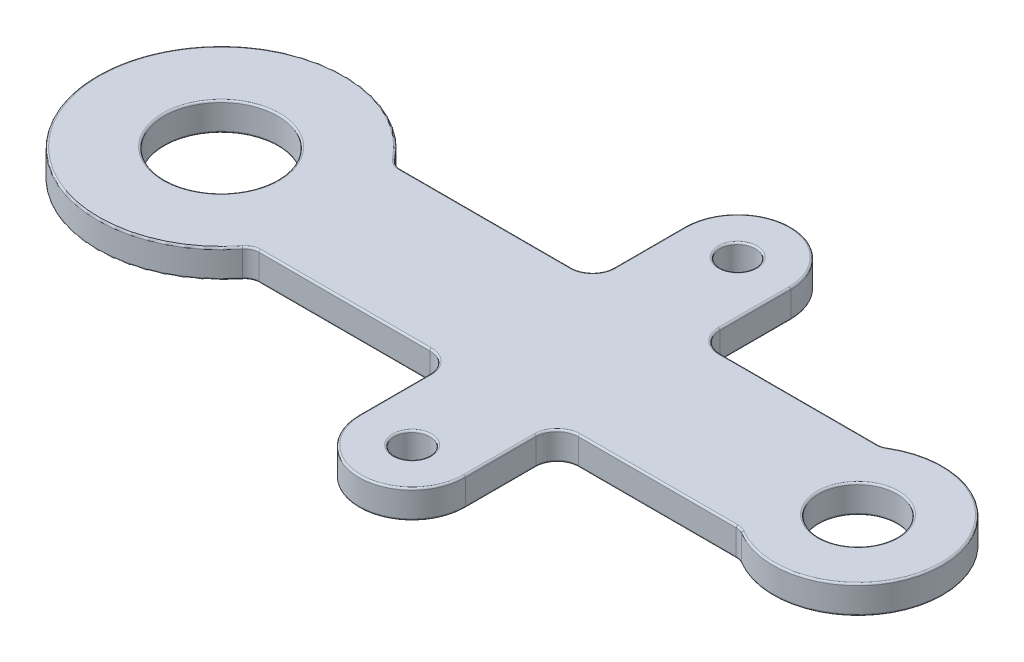
from build123d import *

# Parameters (mm, degrees)
SKETCH_1_R      = 16
SKETCH_1_R_2    = 5
SKETCH_1_R_3    = 11
EXTRUDE_2_DEPTH = 8
FILLET_1_R      = 6
FILLET_2_R      = 6
FILLET_3_R      = 6
FILLET_4_R      = 6
FILLET_5_R      = 4
FILLET_6_R      = 4
FILLET_7_R      = 4
FILLET_8_R      = 4
FILLET_9_R      = 0.5


with BuildPart() as part:
    # 草图1 → 凸台-拉伸2 (new body)
    with BuildSketch(Plane(origin=(0, 0, 0), x_dir=(1, 0, 0), z_dir=(0, 1, 0))):
        with BuildLine():
            Line((28.719409623, 20.004887175), (85, 20.004887175))
            Line((85, 20.004887175), (85, 46))
            ThreePointArc((85, 46), (100, 61), (115, 46))
            Line((115, 46), (115, 20.004887175))
            Line((115, 20.004887175), (166.74087148, 20.004887175))
            ThreePointArc((166.74087148, 20.004887175), (204, 0), (166.74087148, -20.004887175))
            Line((166.74087148, -20.004887175), (115, -20.004887175))
            Line((115, -20.004887175), (115, -46))
            ThreePointArc((115, -46), (100, -61), (85, -46))
            Line((85, -46), (85, -20.004887175))
            Line((85, -20.004887175), (28.719409623, -20.004887175))
            ThreePointArc((28.719409623, -20.004887175), (-35, 0), (28.719409623, 20.004887175))
        make_face()
        with Locations(Location((0, 0, 0), (0, 0, 270))):
            Circle(SKETCH_1_R, mode=Mode.SUBTRACT)
        with Locations(Location((100, 46, 0), (0, 0, 270))):
            Circle(SKETCH_1_R_2, mode=Mode.SUBTRACT)
        with Locations(Location((180, 0, 0), (0, 0, 270))):
            Circle(SKETCH_1_R_3, mode=Mode.SUBTRACT)
        with Locations(Location((100, -46, 0), (0, 0, 90))):
            Circle(SKETCH_1_R_2, mode=Mode.SUBTRACT)
    extrude(amount=EXTRUDE_2_DEPTH)

    # 圆角1
    fillet_1_edges = [part.edges().sort_by_distance(p)[0] for p in [
        (85, 4, -20.004887175),
    ]]
    fillet(fillet_1_edges, radius=FILLET_1_R)

    # 圆角2
    fillet_2_edges = [part.edges().sort_by_distance(p)[0] for p in [
        (115, 4, -20.004887175),
    ]]
    fillet(fillet_2_edges, radius=FILLET_2_R)

    # 圆角3
    fillet_3_edges = [part.edges().sort_by_distance(p)[0] for p in [
        (85, 4, 20.004887175),
    ]]
    fillet(fillet_3_edges, radius=FILLET_3_R)

    # 圆角4
    fillet_4_edges = [part.edges().sort_by_distance(p)[0] for p in [
        (115, 4, 20.004887175),
    ]]
    fillet(fillet_4_edges, radius=FILLET_4_R)

    # 圆角5
    fillet_5_edges = [part.edges().sort_by_distance(p)[0] for p in [
        (166.74087148, 4, 20.004887175),
    ]]
    fillet(fillet_5_edges, radius=FILLET_5_R)

    # 圆角6
    fillet_6_edges = [part.edges().sort_by_distance(p)[0] for p in [
        (28.719409623, 4, 20.004887175),
    ]]
    fillet(fillet_6_edges, radius=FILLET_6_R)

    # 圆角7
    fillet_7_edges = [part.edges().sort_by_distance(p)[0] for p in [
        (166.74087148, 4, -20.004887175),
    ]]
    fillet(fillet_7_edges, radius=FILLET_7_R)

    # 圆角8
    fillet_8_edges = [part.edges().sort_by_distance(p)[0] for p in [
        (28.719409623, 4, -20.004887175),
    ]]
    fillet(fillet_8_edges, radius=FILLET_8_R)

    # 圆角9
    fillet_9_edges = [part.edges().sort_by_distance(p)[0] for p in [
        (166.654322464, 8, 20.150209602),
        (54.868518078, 0, 20.004887175),
        (54.868518078, 8, 20.004887175),
        (28.983205897, 8, 20.409879606),
        (28.983205897, 0, 20.409879606),
        (85, 0, -36.002443588),
        (100, 0, -61),
        (143.292965386, 0, -20.004887175),
        (143.292965386, 8, -20.004887175),
        (166.654322464, 0, -20.150209602),
        (166.654322464, 8, -20.150209602),
        (100, 8, 61),
        (-35, 0, 0),
        (-35, 8, 0),
        (28.983205897, 0, -20.409879606),
        (28.983205897, 8, -20.409879606),
        (115, 0, 36.002443588),
        (100, 0, 61),
        (115, 8, 36.002443588),
        (0, 0, -16),
        (0, 8, -16),
        (100, 8, -61),
        (100, 0, -51),
        (100, 8, -51),
        (85, 8, -36.002443588),
        (100, 0, 51),
        (100, 8, 51),
        (180, 0, -11),
        (180, 8, -11),
        (54.868518078, 0, -20.004887175),
        (54.868518078, 8, -20.004887175),
        (83.242640687, 8, -21.762246488),
        (83.242640687, 0, -21.762246488),
        (115, 0, -36.002443588),
        (115, 8, -36.002443588),
        (116.757359313, 8, -21.762246488),
        (116.757359313, 0, -21.762246488),
        (85, 0, 36.002443588),
        (85, 8, 36.002443588),
        (83.242640687, 0, 21.762246488),
        (83.242640687, 8, 21.762246488),
        (143.292965386, 0, 20.004887175),
        (143.292965386, 8, 20.004887175),
        (116.757359313, 8, 21.762246488),
        (116.757359313, 0, 21.762246488),
        (204, 0, 0),
        (204, 8, 0),
        (166.654322464, 0, 20.150209602),
    ]]
    fillet(fillet_9_edges, radius=FILLET_9_R)


solid = part.part
